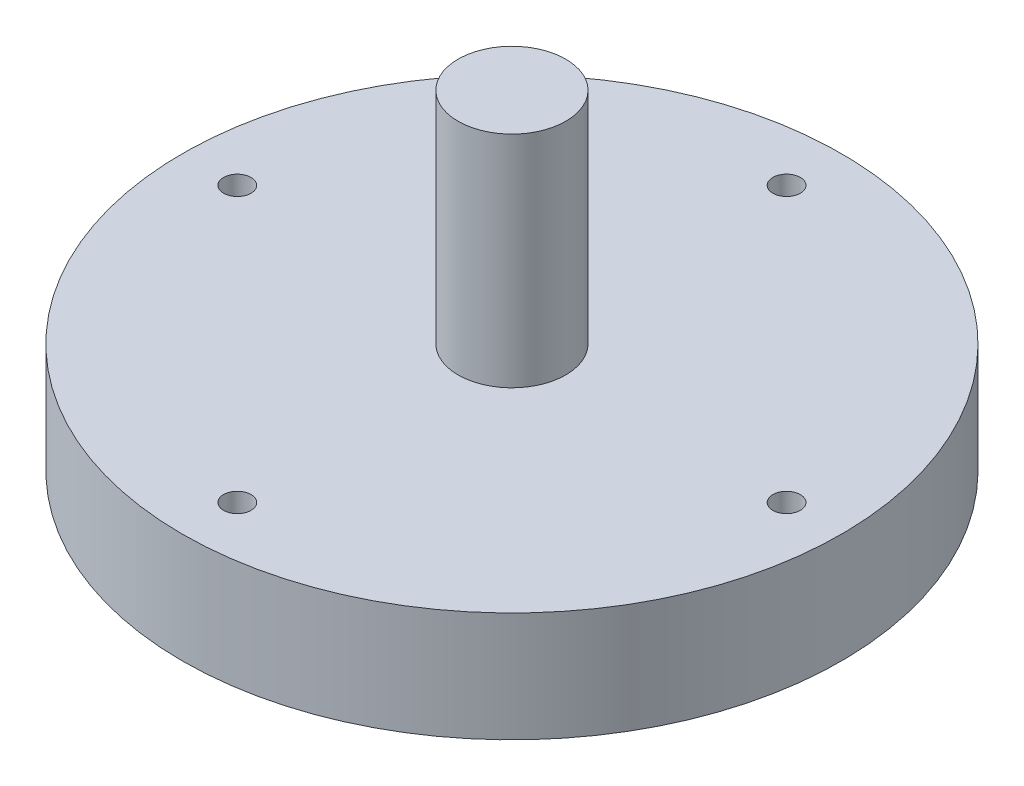
from build123d import *

# Parameters (mm, degrees)
SKETCH1_R           = 38.1
BOSS_EXTRUDE1_DEPTH = 12.7
SKETCH2_R           = 6.223
BOSS_EXTRUDE2_DEPTH = 25.4
SKETCH3_R           = 1.5875
CUT_EXTRUDE1_DEPTH  = 60.56828015
CIRPATTERN1_COUNT   = 4


with BuildPart() as part:
    # Sketch1 → Boss-Extrude1 (new body)
    with BuildSketch(Plane(origin=(0, 0, 0), x_dir=(1, 0, 0), z_dir=(0, 1, 0))):
        with Locations(Location((0, 0, 0), (0, 0, 270))):
            Circle(SKETCH1_R)
    extrude(amount=BOSS_EXTRUDE1_DEPTH)

    # Sketch2 → Boss-Extrude2 (add)
    with BuildSketch(Plane(origin=(0, 12.7, 0), x_dir=(1, 0, 0), z_dir=(0, 1, 0))):
        with Locations(Location((0, 0, 0), (0, 0, 270))):
            Circle(SKETCH2_R)
    extrude(amount=BOSS_EXTRUDE2_DEPTH)

    # Sketch3 → Cut-Extrude1 (cut, through all)
    with BuildSketch(Plane(origin=(0, 12.7, 0), x_dir=(1, 0, 0), z_dir=(0, 1, 0))):
        with Locations(Location((0, 31.75, 0), (0, 0, 270))):
            Circle(SKETCH3_R)
    cut_extrude1 = extrude(amount=-CUT_EXTRUDE1_DEPTH, mode=Mode.SUBTRACT)

    # CirPattern1: Cut-Extrude1 ×4 about axis
    cirpattern1_axis = Axis((0, 0, 0), (0, 1, 0))
    for i in range(1, CIRPATTERN1_COUNT):
        add(cut_extrude1.rotate(cirpattern1_axis, i * 360 / CIRPATTERN1_COUNT), mode=Mode.SUBTRACT)


solid = part.part
